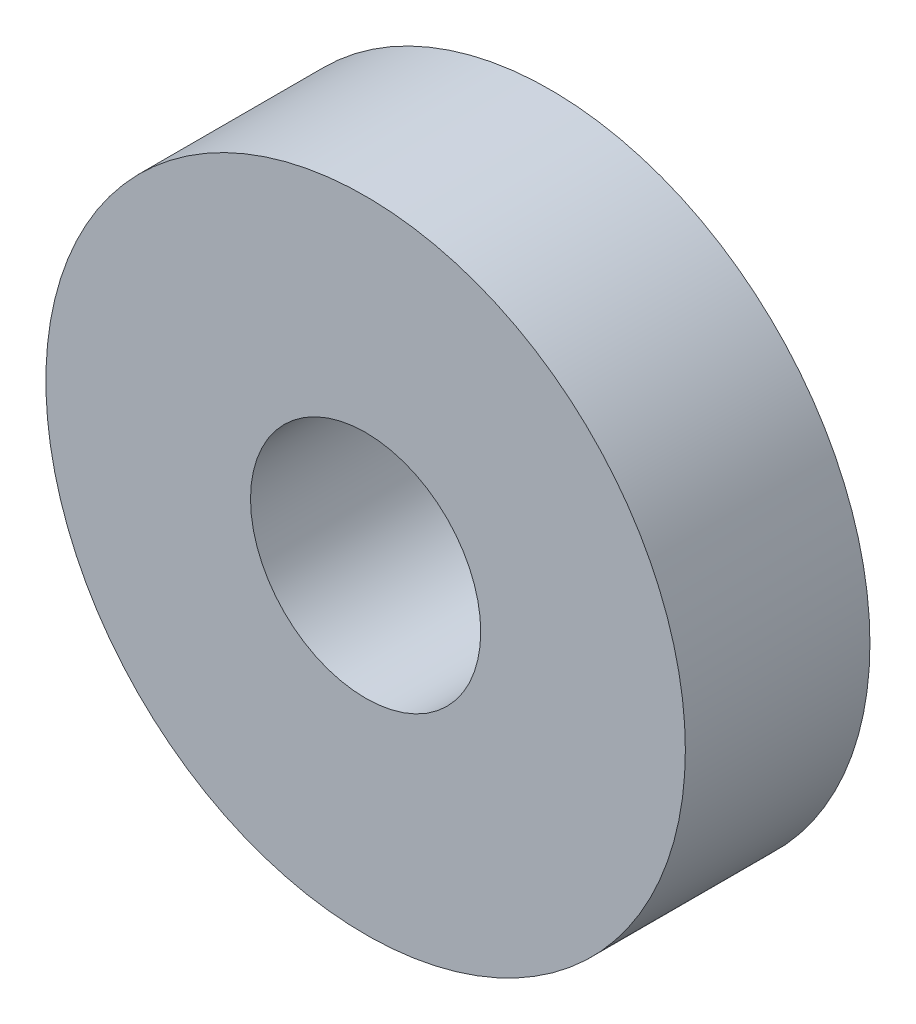
from build123d import *

# Parameters (mm, degrees)
ESQUISSE1_R        = 11
ESQUISSE1_R_2      = 3.96
BOSS_EXTRU_1_DEPTH = 6.35


with BuildPart() as part:
    # Esquisse1 → Boss.-Extru.1 (new body)
    with BuildSketch(Plane.XY):
        Circle(ESQUISSE1_R)
        Circle(ESQUISSE1_R_2, mode=Mode.SUBTRACT)
    extrude(amount=BOSS_EXTRU_1_DEPTH)


solid = part.part
